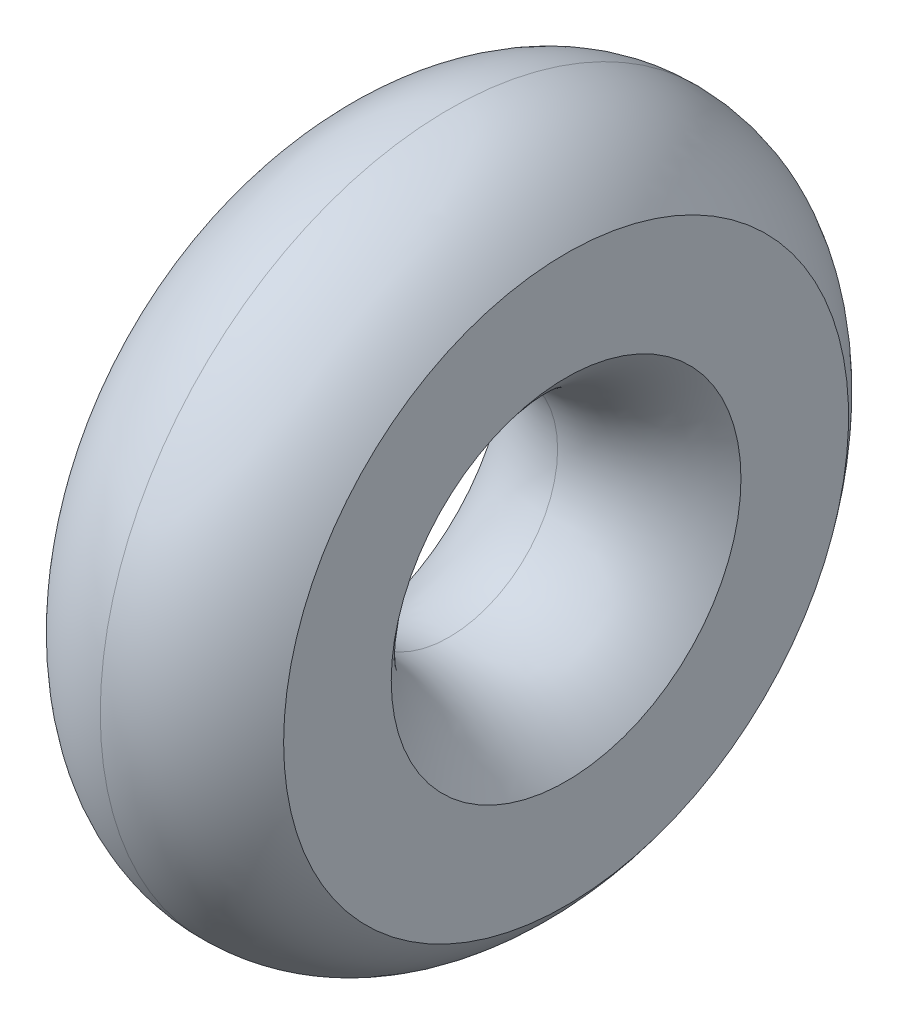
from build123d import *


with BuildPart() as part:
    # 草图2 → 旋转1 (revolve)
    with BuildSketch(Plane(origin=(7.302382416, -265.73073656, 26.003377612), x_dir=(-1, 0, 0), z_dir=(0, -0.09739092738513833, -0.9952462043449665))):
        with BuildLine():
            Line((32.689921627, 372), (32.689921627, 332))
            add(Edge.make_bspline(
                [(32.689921627, 332), (14.195979899, 307.336727041), (-10.804020101, 307.336727041)],
                knots=[0, 0, 0, 1, 1, 1], degree=2))
            add(Edge.make_bspline(
                [(-54.297961828, 332), (-35.804020101, 307.336727041), (-10.804020101, 307.336727041)],
                knots=[0, 0, 0, 1, 1, 1], degree=2))
            Line((-54.297961828, 332), (-54.297961828, 372))
            add(Edge.make_bspline(
                [(-54.297961828, 372), (-35.804020101, 396.663272959), (-10.804020101, 396.663272959)],
                knots=[0, 0, 0, 1, 1, 1], degree=2))
            add(Edge.make_bspline(
                [(32.689921627, 372), (14.195979899, 396.663272959), (-10.804020101, 396.663272959)],
                knots=[0, 0, 0, 1, 1, 1], degree=2))
        make_face()
    revolve(axis=Axis((-55.975964986, 0, 0), (1, 0, 0)))


solid = part.part
